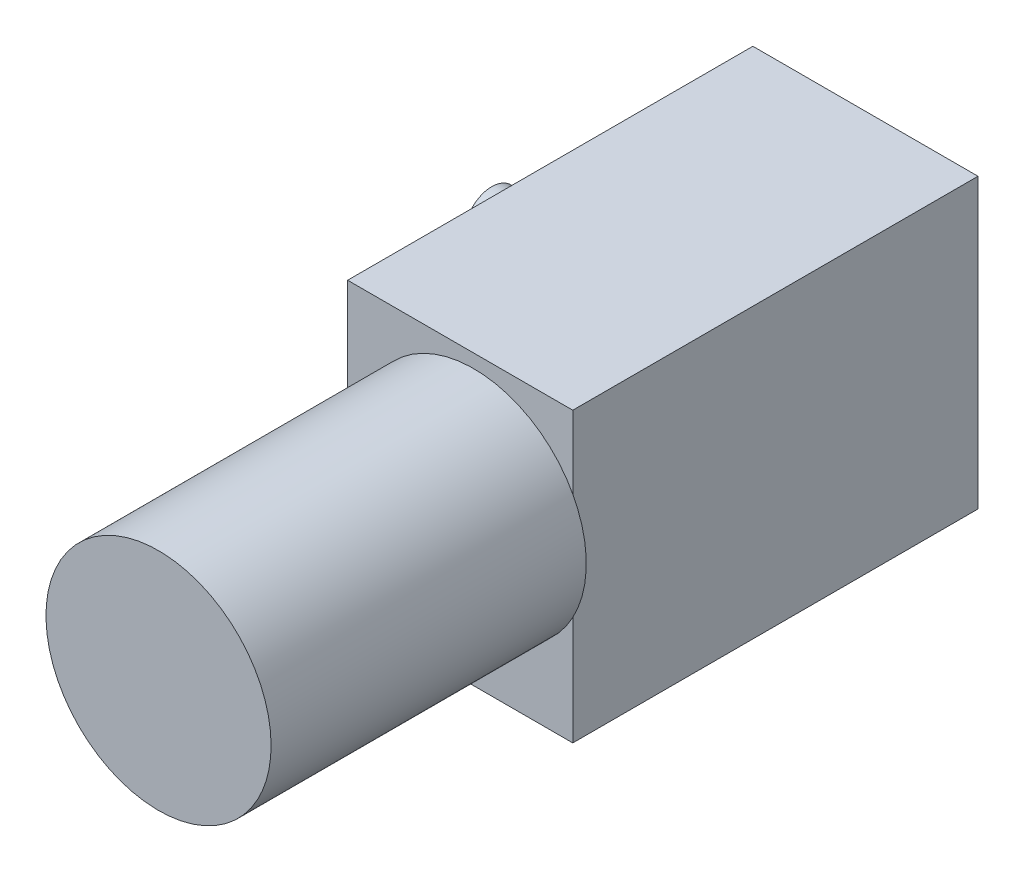
from build123d import *

# Parameters (mm, degrees)
SKETCH1_W           = 45
SKETCH1_H           = 32
BOSS_EXTRUDE1_DEPTH = 25
SKETCH2_R           = 12.5
BOSS_EXTRUDE2_DEPTH = 35
SKETCH3_R           = 3
BOSS_EXTRUDE3_DEPTH = 14
SKETCH4_R           = 1.5
CUT_EXTRUDE1_DEPTH  = 5


with BuildPart() as part:
    # Sketch1 → Boss-Extrude1 (new body)
    with BuildSketch(Plane(origin=(0, 0, 0), x_dir=(0, 0, -1), z_dir=(1, 0, 0))):
        with Locations((-5.67718197, -8.795606883)):
            Rectangle(SKETCH1_W, SKETCH1_H)
    extrude(amount=BOSS_EXTRUDE1_DEPTH)

    # Sketch2 → Boss-Extrude2 (add)
    with BuildSketch(Plane.XY.offset(28.17718197)):
        with Locations(Location((14, -6.795606883, 0), (0, 0, 331.642363424))):
            Circle(SKETCH2_R)
    extrude(amount=BOSS_EXTRUDE2_DEPTH)

    # Sketch3 → Boss-Extrude3 (add)
    with BuildSketch(Plane.ZY):
        with Locations(Location((-1.82281803, -8.795606883, 0), (0, 0, 180))):
            Circle(SKETCH3_R)
    extrude(amount=BOSS_EXTRUDE3_DEPTH)

    # Sketch4 → Cut-Extrude1 (cut)
    with BuildSketch(Plane.ZY):
        with Locations((-10.82281803, 0.204393117)):
            Circle(SKETCH4_R)
        with Locations((22.17718197, 0.204393117)):
            Circle(SKETCH4_R)
        with Locations((22.17718197, -17.795606883)):
            Circle(SKETCH4_R)
        with Locations((-10.82281803, -17.795606883)):
            Circle(SKETCH4_R)
    extrude(amount=-CUT_EXTRUDE1_DEPTH, mode=Mode.SUBTRACT)


solid = part.part
